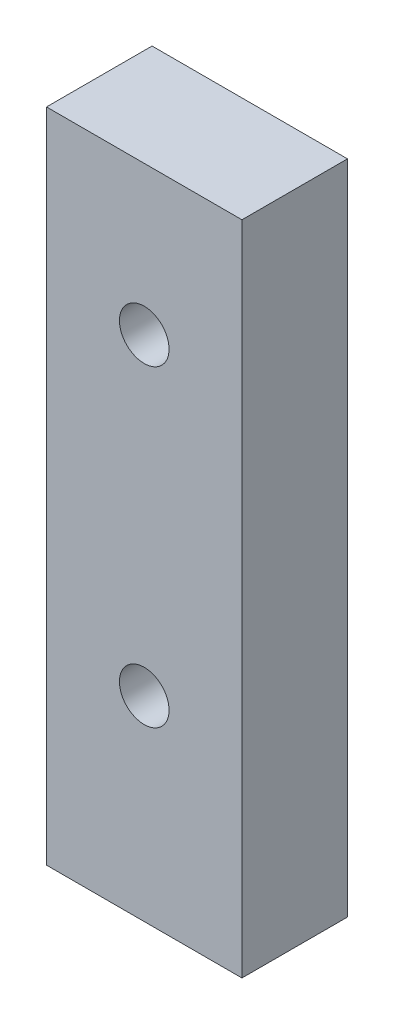
from build123d import *

# Parameters (mm, degrees)
SKETCH1_W           = 25
SKETCH1_H           = 84
BOSS_EXTRUDE1_DEPTH = 13.5
SKETCH2_R           = 3.175
CUT_EXTRUDE1_DEPTH  = 13.5


with BuildPart() as part:
    # Sketch1 → Boss-Extrude1 (new body)
    with BuildSketch(Plane.XY):
        with Locations((12.5, 42)):
            Rectangle(SKETCH1_W, SKETCH1_H)
    extrude(amount=BOSS_EXTRUDE1_DEPTH)

    # Sketch2 → Cut-Extrude1 (cut)
    with BuildSketch(Plane.XY.offset(13.5)):
        with Locations((12.5, 65)):
            Circle(SKETCH2_R)
        with Locations((12.5, 25)):
            Circle(SKETCH2_R)
    extrude(amount=-CUT_EXTRUDE1_DEPTH, mode=Mode.SUBTRACT)


solid = part.part
